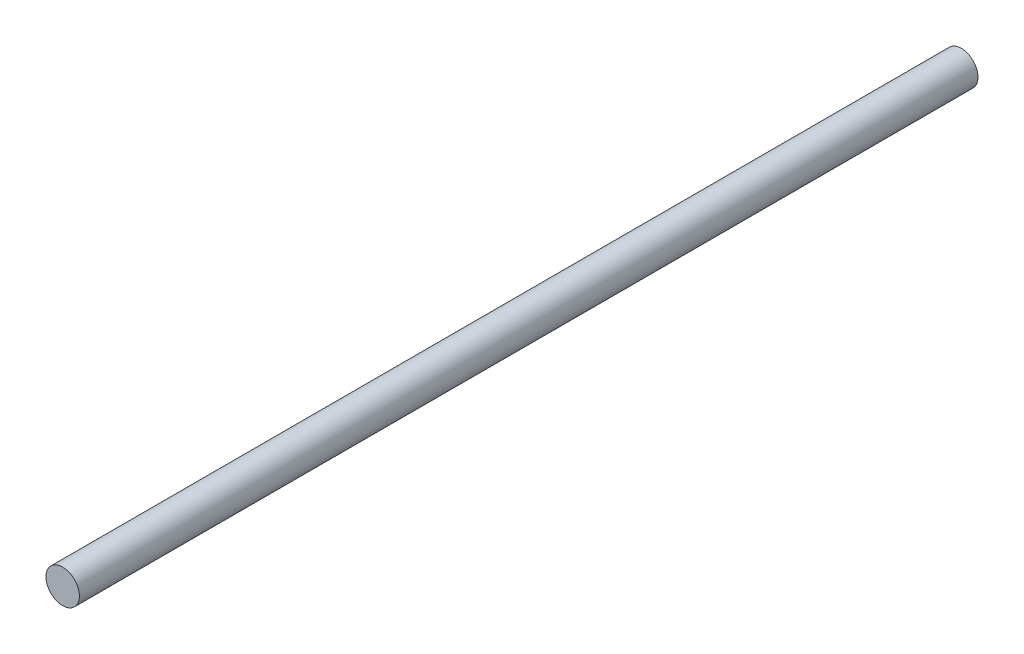
from build123d import *

# Parameters (mm, degrees)
SKETCH_1_R      = 4
EXTRUDE_1_DEPTH = 215


with BuildPart() as part:
    # 草圖1 → 填料-伸長1 (new body)
    with BuildSketch(Plane.XY):
        with Locations((0, 0.165675446)):
            Circle(SKETCH_1_R)
    extrude(amount=EXTRUDE_1_DEPTH)


solid = part.part
